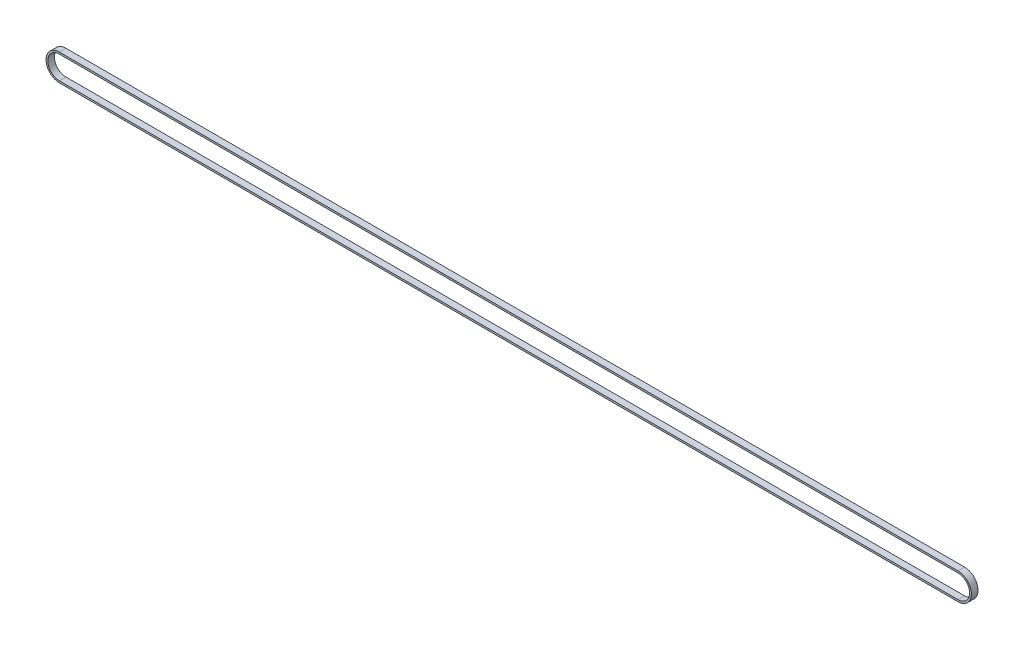
from build123d import *

# Parameters (mm, degrees)
EXTRUDE_THIN1_DEPTH = 2.5


with BuildPart() as part:
    # Sketch1 → Extrude-Thin1 (new, symmetric)
    with BuildSketch(Plane.XY):
        with BuildLine():
            Line((682, -10.13), (0, -10.13))
            ThreePointArc((0, -10.13), (-10.13, 0), (0, 10.13))
            Line((0, 10.13), (682, 10.13))
            ThreePointArc((682, 10.13), (692.13, 0), (682, -10.13))
        make_face()
        with BuildLine():
            Line((682, -8.75), (0, -8.75))
            ThreePointArc((0, -8.75), (-8.75, 0), (0, 8.75))
            Line((0, 8.75), (682, 8.75))
            ThreePointArc((682, 8.75), (690.75, 0), (682, -8.75))
        make_face(mode=Mode.SUBTRACT)
    extrude(amount=EXTRUDE_THIN1_DEPTH, both=True)


solid = part.part
